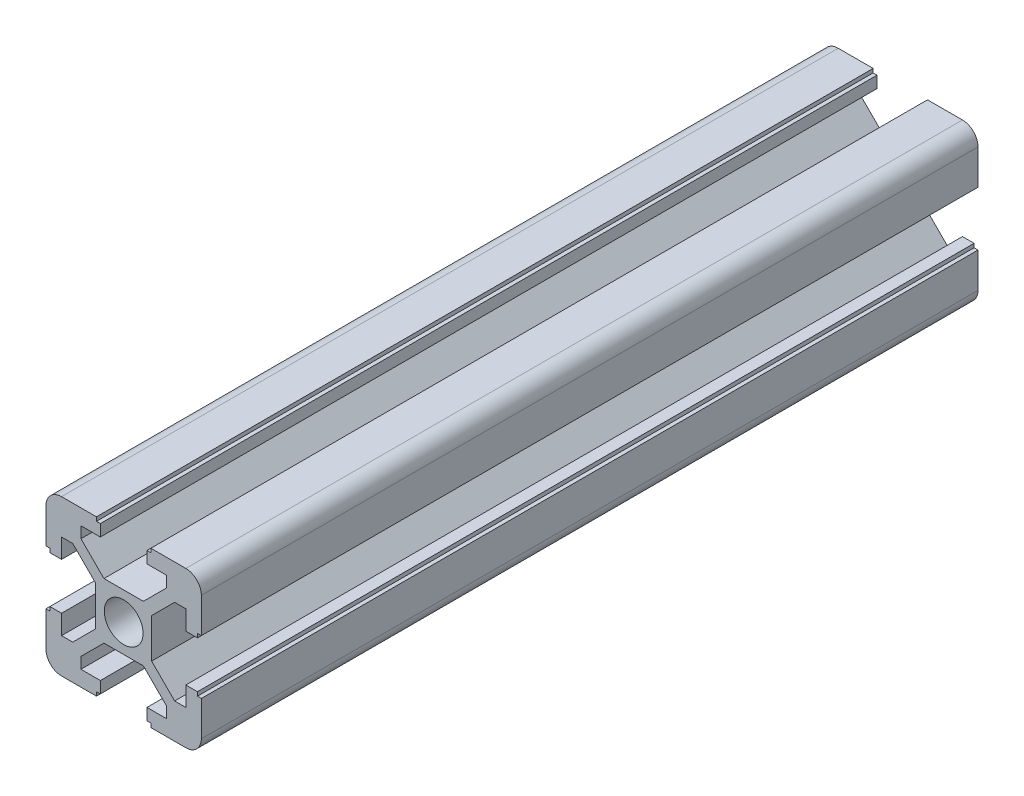
from build123d import *

# Parameters (mm, degrees)
SKETCH1_R           = 2.5
BOSS_EXTRUDE1_DEPTH = 100


with BuildPart() as part:
    # Sketch1 → Boss-Extrude1 (new body)
    with BuildSketch(Plane.XY):
        with BuildLine():
            Line((8, -3), (8, -5.5))
            Line((8, -5.5), (6.560660172, -5.5))
            Line((6.560660172, -5.5), (3.6, -2.539339828))
            Line((3.6, -2.539339828), (3.6, 2.539339828))
            Line((3.6, 2.539339828), (6.560660172, 5.5))
            Line((6.560660172, 5.5), (8, 5.5))
            Line((8, 5.5), (8, 3))
            Line((8, 3), (9.5, 3))
            Line((9.5, 3), (9.5, 3.5))
            Line((9.5, 3.5), (10, 3.5))
            Line((10, 3.5), (10, 8))
            ThreePointArc((10, 8), (9.414213562, 9.414213562), (8, 10))
            Line((8, 10), (3.5, 10))
            Line((3.5, 10), (3.5, 9.5))
            Line((3.5, 9.5), (3, 9.5))
            Line((3, 9.5), (3, 8))
            Line((3, 8), (5.5, 8))
            Line((5.5, 8), (5.5, 6.560660172))
            Line((5.5, 6.560660172), (2.539339828, 3.6))
            Line((2.539339828, 3.6), (-2.539339828, 3.6))
            Line((-2.539339828, 3.6), (-5.5, 6.560660172))
            Line((-5.5, 6.560660172), (-5.5, 8))
            Line((-5.5, 8), (-3, 8))
            Line((-3, 8), (-3, 9.5))
            Line((-3, 9.5), (-3.5, 9.5))
            Line((-3.5, 9.5), (-3.5, 10))
            Line((-3.5, 10), (-8, 10))
            ThreePointArc((-8, 10), (-9.414213562, 9.414213562), (-10, 8))
            Line((-10, 8), (-10, 3.5))
            Line((-10, 3.5), (-9.5, 3.5))
            Line((-9.5, 3.5), (-9.5, 3))
            Line((-9.5, 3), (-8, 3))
            Line((-8, 3), (-8, 5.5))
            Line((-8, 5.5), (-6.560660172, 5.5))
            Line((-6.560660172, 5.5), (-3.6, 2.539339828))
            Line((-3.6, 2.539339828), (-3.6, -2.539339828))
            Line((-3.6, -2.539339828), (-6.560660172, -5.5))
            Line((-6.560660172, -5.5), (-8, -5.5))
            Line((-8, -5.5), (-8, -3))
            Line((-8, -3), (-9.5, -3))
            Line((-9.5, -3), (-9.5, -3.5))
            Line((-9.5, -3.5), (-10, -3.5))
            Line((-10, -3.5), (-10, -8))
            ThreePointArc((-10, -8), (-9.414213562, -9.414213562), (-8, -10))
            Line((-8, -10), (-3.5, -10))
            Line((-3.5, -10), (-3.5, -9.5))
            Line((-3.5, -9.5), (-3, -9.5))
            Line((-3, -9.5), (-3, -8))
            Line((-3, -8), (-5.5, -8))
            Line((-5.5, -8), (-5.5, -6.560660172))
            Line((-5.5, -6.560660172), (-2.539339828, -3.6))
            Line((-2.539339828, -3.6), (2.539339828, -3.6))
            Line((2.539339828, -3.6), (5.5, -6.560660172))
            Line((5.5, -6.560660172), (5.5, -8))
            Line((5.5, -8), (3, -8))
            Line((3, -8), (3, -9.5))
            Line((3, -9.5), (3.5, -9.5))
            Line((3.5, -9.5), (3.5, -10))
            Line((3.5, -10), (8, -10))
            ThreePointArc((8, -10), (9.414213562, -9.414213562), (10, -8))
            Line((10, -8), (10, -3.5))
            Line((10, -3.5), (9.5, -3.5))
            Line((9.5, -3.5), (9.5, -3))
            Line((9.5, -3), (8, -3))
        make_face()
        Circle(SKETCH1_R, mode=Mode.SUBTRACT)
    extrude(amount=BOSS_EXTRUDE1_DEPTH)


solid = part.part
